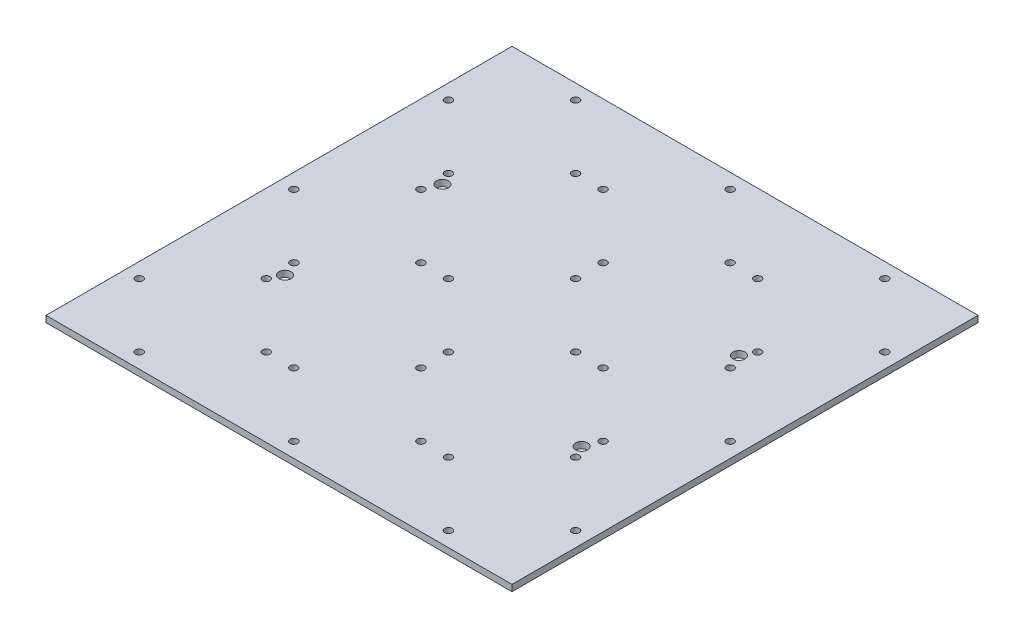
from build123d import *

# Parameters (mm, degrees)
SKETCH1_W           = 220
SKETCH1_H           = 220
BOSS_EXTRUDE1_DEPTH = 3
SKETCH3_R           = 2.85
CUT_EXTRUDE5_DEPTH  = 156.592416268
SKETCH2_R           = 1.7526
CUT_EXTRUDE6_DEPTH  = 156.592416268


with BuildPart() as part:
    # Sketch1 → Boss-Extrude1 (new body)
    with BuildSketch(Plane(origin=(0, 0, 0), x_dir=(1, 0, 0), z_dir=(0, 1, 0))):
        Rectangle(SKETCH1_W, SKETCH1_H)
    extrude(amount=BOSS_EXTRUDE1_DEPTH)

    # Sketch3 → Cut-Extrude5 (cut, through all)
    with BuildSketch(Plane(origin=(0, 3, 0), x_dir=(1, 0, 0), z_dir=(0, 1, 0))):
        with Locations(Location((70, -37.15, 0), (0, 0, 90))):
            Circle(SKETCH3_R)
        with Locations(Location((-70, -37.15, 0), (0, 0, 270))):
            Circle(SKETCH3_R)
        with Locations(Location((-70, 37.15, 0), (0, 0, 90))):
            Circle(SKETCH3_R)
        with Locations(Location((70, 37.15, 0), (0, 0, 270))):
            Circle(SKETCH3_R)
    extrude(amount=-CUT_EXTRUDE5_DEPTH, mode=Mode.SUBTRACT)

    # Sketch2 → Cut-Extrude6 (cut, through all)
    with BuildSketch(Plane(origin=(0, 3, 0), x_dir=(1, 0, 0), z_dir=(0, 1, 0))):
        with Locations(Location((-73, 103, 0), (0, 0, 270))):
            Circle(SKETCH2_R)
        with Locations(Location((0, 103, 0), (0, 0, 270))):
            Circle(SKETCH2_R)
        with Locations(Location((-30, 73, 0), (0, 0, 270))):
            Circle(SKETCH2_R)
        with Locations(Location((-103, 73, 0), (0, 0, 270))):
            Circle(SKETCH2_R)
        with Locations(Location((-43, 73, 0), (0, 0, 270))):
            Circle(SKETCH2_R)
        with Locations(Location((0, 43, 0), (0, 0, 270))):
            Circle(SKETCH2_R)
        with Locations(Location((30, 73, 0), (0, 0, 270))):
            Circle(SKETCH2_R)
        with Locations(Location((73, 103, 0), (0, 0, 270))):
            Circle(SKETCH2_R)
        with Locations(Location((43, 73, 0), (0, 0, 270))):
            Circle(SKETCH2_R)
        with Locations(Location((-73, 43, 0), (0, 0, 270))):
            Circle(SKETCH2_R)
        with Locations(Location((73, 43, 0), (0, 0, 270))):
            Circle(SKETCH2_R)
        with Locations(Location((103, 73, 0), (0, 0, 270))):
            Circle(SKETCH2_R)
        with Locations(Location((0, 30, 0), (0, 0, 270))):
            Circle(SKETCH2_R)
        with Locations(Location((-30, 0, 0), (0, 0, 270))):
            Circle(SKETCH2_R)
        with Locations(Location((0, -30, 0), (0, 0, 270))):
            Circle(SKETCH2_R)
        with Locations(Location((30, 0, 0), (0, 0, 270))):
            Circle(SKETCH2_R)
        with Locations(Location((73, 30, 0), (0, 0, 270))):
            Circle(SKETCH2_R)
        with Locations(Location((43, 0, 0), (0, 0, 270))):
            Circle(SKETCH2_R)
        with Locations(Location((73, -30, 0), (0, 0, 270))):
            Circle(SKETCH2_R)
        with Locations(Location((103, 0, 0), (0, 0, 270))):
            Circle(SKETCH2_R)
        with Locations(Location((0, -43, 0), (0, 0, 270))):
            Circle(SKETCH2_R)
        with Locations(Location((-30, -73, 0), (0, 0, 270))):
            Circle(SKETCH2_R)
        with Locations(Location((0, -103, 0), (0, 0, 270))):
            Circle(SKETCH2_R)
        with Locations(Location((30, -73, 0), (0, 0, 270))):
            Circle(SKETCH2_R)
        with Locations(Location((73, -43, 0), (0, 0, 270))):
            Circle(SKETCH2_R)
        with Locations(Location((43, -73, 0), (0, 0, 270))):
            Circle(SKETCH2_R)
        with Locations(Location((73, -103, 0), (0, 0, 270))):
            Circle(SKETCH2_R)
        with Locations(Location((103, -73, 0), (0, 0, 270))):
            Circle(SKETCH2_R)
        with Locations(Location((-73, 30, 0), (0, 0, 270))):
            Circle(SKETCH2_R)
        with Locations(Location((-103, 0, 0), (0, 0, 270))):
            Circle(SKETCH2_R)
        with Locations(Location((-73, -30, 0), (0, 0, 270))):
            Circle(SKETCH2_R)
        with Locations(Location((-43, 0, 0), (0, 0, 270))):
            Circle(SKETCH2_R)
        with Locations(Location((-73, -43, 0), (0, 0, 270))):
            Circle(SKETCH2_R)
        with Locations(Location((-103, -73, 0), (0, 0, 270))):
            Circle(SKETCH2_R)
        with Locations(Location((-73, -103, 0), (0, 0, 270))):
            Circle(SKETCH2_R)
        with Locations(Location((-43, -73, 0), (0, 0, 270))):
            Circle(SKETCH2_R)
    extrude(amount=-CUT_EXTRUDE6_DEPTH, mode=Mode.SUBTRACT)


solid = part.part
